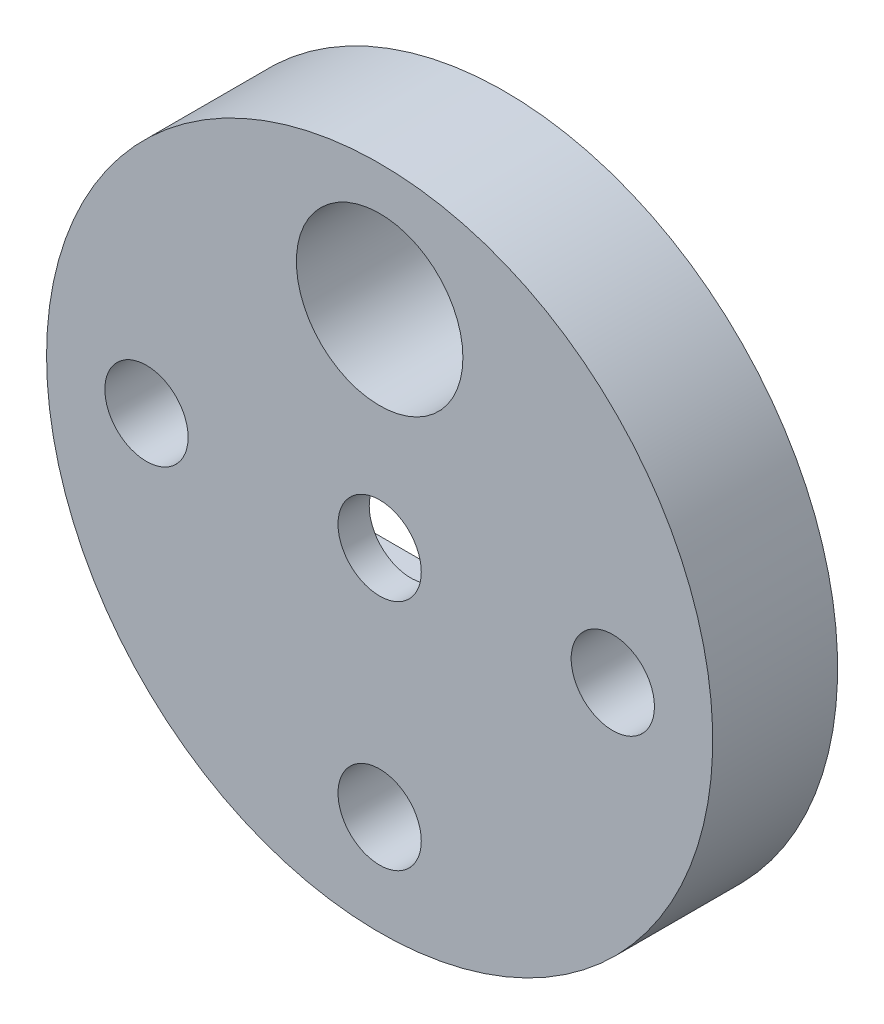
from build123d import *

# Parameters (mm, degrees)
SKETCH1_R           = 25.4
BOSS_EXTRUDE1_DEPTH = 9.525
SKETCH2_W           = 20.6375
SKETCH2_H           = 17.4625
CUT_EXTRUDE1_DEPTH  = 7.14375
SKETCH3_R           = 3.175
CUT_EXTRUDE9_DEPTH  = 15.5575
SKETCH5_R           = 6.35
SKETCH5_R_2         = 3.175
CUT_EXTRUDE10_DEPTH = 15.5575


with BuildPart() as part:
    # Sketch1 → Boss-Extrude1 (new body)
    with BuildSketch(Plane.XY):
        with Locations(Location((0, 0, 0), (0, 0, 180))):
            Circle(SKETCH1_R)
    extrude(amount=BOSS_EXTRUDE1_DEPTH)

    # Sketch2 → Cut-Extrude1 (cut)
    with BuildSketch(Plane.XY):
        Rectangle(SKETCH2_W, SKETCH2_H)
    extrude(amount=CUT_EXTRUDE1_DEPTH, mode=Mode.SUBTRACT)

    # Sketch3 → Cut-Extrude9 (cut)
    with BuildSketch(Plane(origin=(0, 0, 7.14375), x_dir=(-1, 0, 0), z_dir=(0, 0, -1))):
        Circle(SKETCH3_R)
    extrude(amount=-CUT_EXTRUDE9_DEPTH, mode=Mode.SUBTRACT)

    # Sketch5 → Cut-Extrude10 (cut)
    with BuildSketch(Plane.XY.offset(9.525)):
        with Locations((0, 15.748)):
            Circle(SKETCH5_R)
        with Locations((17.78, 0)):
            Circle(SKETCH5_R_2)
        with Locations((0, -17.768897269)):
            Circle(SKETCH5_R_2)
        with Locations((-17.78, 0)):
            Circle(SKETCH5_R_2)
    extrude(amount=-CUT_EXTRUDE10_DEPTH, mode=Mode.SUBTRACT)


solid = part.part
